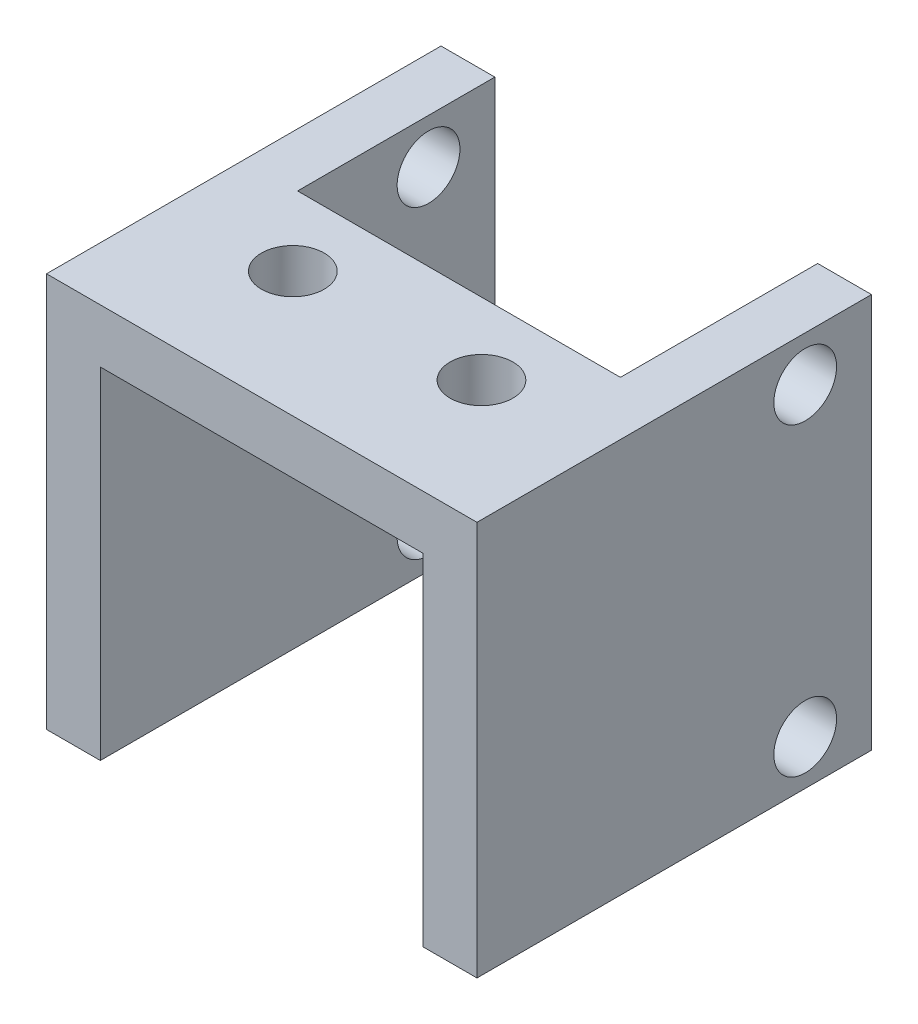
from build123d import *

# Parameters (mm, degrees)
SKETCH_1_W                  = 22
SKETCH_1_H                  = 21.992162459
EXTRUDE_1_DEPTH             = 2.999999998
EXTRUDE_2_DEPTH             = 10.99608123
SKETCH_3_W                  = 3
SKETCH_3_H                  = 22
EXTRUDE_3_DEPTH             = 10.996081229
HOLE_WIZARD_3_5_3_5_1_D     = 3.5
HOLE_WIZARD_3_5_3_5_1_DEPTH = 22.000025
HOLE_WIZARD_3_5_3_5_2_D     = 3.5
HOLE_WIZARD_3_5_3_5_2_DEPTH = 3
HOLE_WIZARD_3_5_3_5_3_D     = 3.5


with BuildPart() as part:
    # 스케치1 → 보스-돌출1 (new body)
    with BuildSketch(Plane(origin=(-11.99726579, 0, 0), x_dir=(0, -1, 0), z_dir=(-1, 0, 0))):
        with Locations((11, -15.30483348)):
            Rectangle(SKETCH_1_W, SKETCH_1_H)
    extrude(amount=-EXTRUDE_1_DEPTH)

    # 스케치2 → 보스-돌출2 (add)
    with BuildSketch(Plane.XY.offset(-4.30875225)):
        Polygon((12, 0), (-8.99726579, 0), (-8.99726579, -2.999999996), (9, -2.999999996), (9, -21.999999998), (12, -21.999999998), align=None)
    extrude(amount=-EXTRUDE_2_DEPTH)

    # 스케치3 → 보스-돌출3 (add)
    with BuildSketch(Plane(origin=(0, 0, -15.30483348), x_dir=(-1.0, 0, 5.95310697820905e-12), z_dir=(-5.95310697820905e-12, 0, -1.0))):
        with Locations((-10.5, -11)):
            Rectangle(SKETCH_3_W, SKETCH_3_H)
    extrude(amount=EXTRUDE_3_DEPTH)

    # Ø3.5 (3.5) 지름 구멍1
    with Locations(Plane(origin=(0, 0, 0), x_dir=(1, 0, 0), z_dir=(0, 1, 0))):
        with Locations((-5.258745872, 11.300890987), (5.258745872, 11.300890987)):
            Hole(HOLE_WIZARD_3_5_3_5_1_D / 2, depth=HOLE_WIZARD_3_5_3_5_1_DEPTH)

    # Ø3.5 (3.5) 지름 구멍2
    with Locations(Plane.ZY.offset(-9)):
        with Locations((-22.606276953, -19.5), (-22.606276953, -2.5)):
            Hole(HOLE_WIZARD_3_5_3_5_2_D / 2, depth=HOLE_WIZARD_3_5_3_5_2_DEPTH)

    # Ø3.5 (3.5) 지름 구멍3 (through all)
    with Locations(Plane(origin=(-8.997265792, 0, 0), x_dir=(0, 0, -1), z_dir=(1, 0, 0))):
        with Locations((22.606276953, -19.5), (22.606276953, -2.5)):
            Hole(HOLE_WIZARD_3_5_3_5_3_D / 2)


solid = part.part
